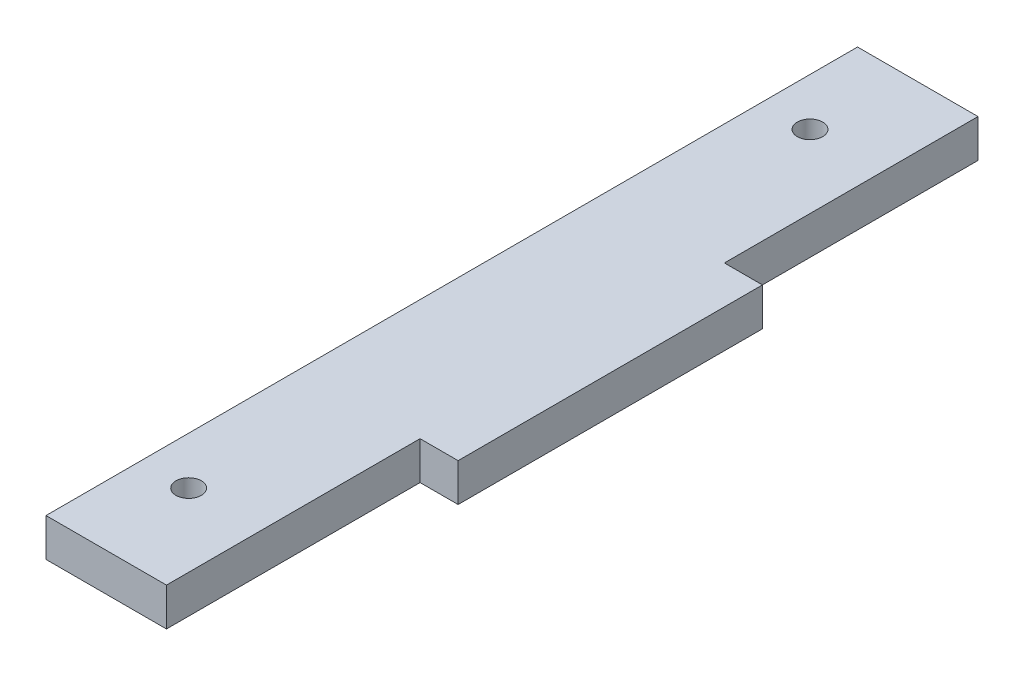
from build123d import *

# Parameters (mm, degrees)
BOSS_EXTRUDE1_DEPTH = 6
SKETCH2_R           = 2
CUT_EXTRUDE1_DEPTH  = 71.989922019


with BuildPart() as part:
    # Sketch1 → Boss-Extrude1 (new body)
    with BuildSketch(Plane(origin=(0, 0, 0), x_dir=(1, 0, 0), z_dir=(0, 1, 0))):
        Polygon((4.371579812, 18.793220339), (4.371579812, 58.793220339), (-14.628420188, 58.793220339), (-14.628420188, -69.206779661), (4.371579812, -69.206779661), (4.371579812, -29.206779661), (10.371579812, -29.206779661), (10.371579812, 18.793220339), align=None)
    extrude(amount=BOSS_EXTRUDE1_DEPTH)

    # Sketch2 → Cut-Extrude1 (cut, through all)
    with BuildSketch(Plane(origin=(0, 6, 0), x_dir=(1, 0, 0), z_dir=(0, 1, 0))):
        with Locations((-7.128420188, -54.206779661)):
            Circle(SKETCH2_R)
        with Locations((-7.128420188, 43.793220339)):
            Circle(SKETCH2_R)
    extrude(amount=-CUT_EXTRUDE1_DEPTH, mode=Mode.SUBTRACT)


solid = part.part
